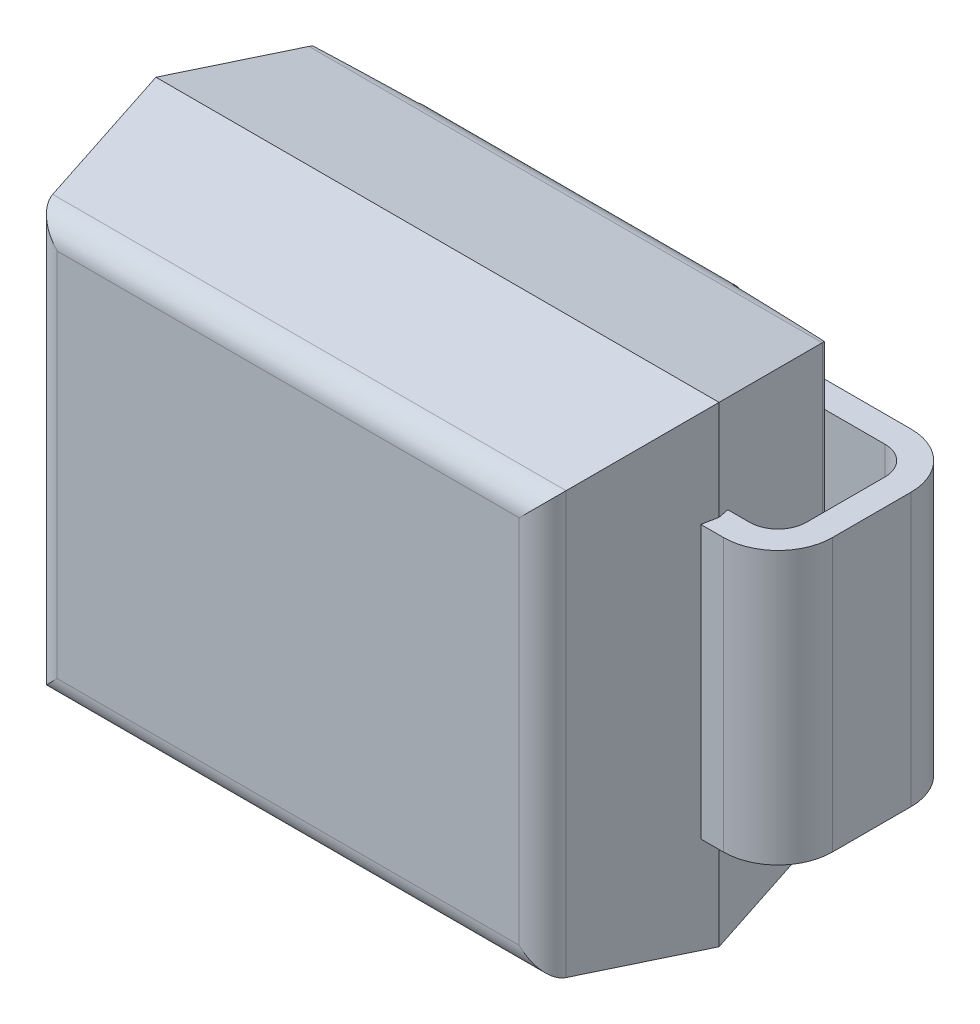
from build123d import *

# Parameters (mm, degrees)
SKETCH1_W                = 4.3
SKETCH1_H                = 3.6
EXTRUDE1_DEPTH           = 1.14
EXTRUDE1_TAPER           = 11
EXTRUDE1_OTHER_WAY_DEPTH = 1.14
EXTRUDE1_OTHER_WAY_TAPER = 11
FILLET1_R                = 0.2
CUT_EXTRUDE2_DEPTH       = 10.2
CUT_EXTRUDE2_DEPTH_BACK  = 10.2
SKETCH6_W                = 0.2
SKETCH6_H                = 2.08


with BuildPart() as part:
    # Sketch1 → Extrude1 (new body)
    with BuildSketch(Plane.XY):
        Rectangle(SKETCH1_W, SKETCH1_H)
    extrude(amount=EXTRUDE1_DEPTH, taper=EXTRUDE1_TAPER)

    # Sketch1 → Extrude1 other way (add)
    with BuildSketch(Plane.XY):
        Rectangle(SKETCH1_W, SKETCH1_H)
    extrude(amount=-EXTRUDE1_OTHER_WAY_DEPTH, taper=EXTRUDE1_OTHER_WAY_TAPER)

    # Fillet1
    fillet1_edges = [part.edges().sort_by_distance(p)[0] for p in [
        (1.928406448, 0, 1.14),
        (-1.928406448, 0, -1.14),
        (0, 1.578406448, -1.14),
        (1.928406448, 0, -1.14),
        (0, 1.578406448, 1.14),
        (0, -1.578406448, -1.14),
        (-1.928406448, 0, 1.14),
        (0, -1.578406448, 1.14),
    ]]
    fillet(fillet1_edges, radius=FILLET1_R)

    # Sketch4 → Cut-Extrude2 (cut, two sides: drawn at the far end of the back side and taken through both)
    with BuildSketch(Plane(origin=(0, 0, 0), x_dir=(1, 0, 0), z_dir=(0, 1, 0)).offset(-CUT_EXTRUDE2_DEPTH_BACK)):
        Polygon((1.2, 1.05), (3.492421082, 0.9), (3.492421082, 2.05), (1.2, 2.05), align=None)
        Polygon((-3.627687387, 2.05), (-1.2, 2.05), (-1.2, 1.05), (-3.627687387, 0.9), align=None)
    extrude(amount=CUT_EXTRUDE2_DEPTH + CUT_EXTRUDE2_DEPTH_BACK, mode=Mode.SUBTRACT)

    # Sweep1: sweep along a path in Sketch5
    with BuildLine(Plane(origin=(0, 0, 0), x_dir=(1, 0, 0), z_dir=(0, 1, 0))) as sweep1_path:
        Line((0, 0), (2.3, 0))
        ThreePointArc((2.3, 0), (2.512132034, 0.087867966), (2.6, 0.3))
        Line((2.6, 0.3), (2.6, 0.9))
        ThreePointArc((2.6, 0.9), (2.512132034, 1.112132034), (2.3, 1.2))
        Line((2.3, 1.2), (1.4, 1.2))
    # Sketch6 → Sweep1 (sweep)
    with BuildSketch(Plane(origin=(0, 0, 0), x_dir=(0, 0, -1), z_dir=(1, 0, 0))):
        with Locations((-0.016698904, 0)):
            Rectangle(SKETCH6_W, SKETCH6_H)
    sweep1 = sweep(path=sweep1_path.line)

    # Mirror1: Sweep1 across plane
    add(sweep1.mirror(Plane(origin=(0, 0, 0), x_dir=(0, 0, 1), z_dir=(1, 0, 0))))


solid = part.part
